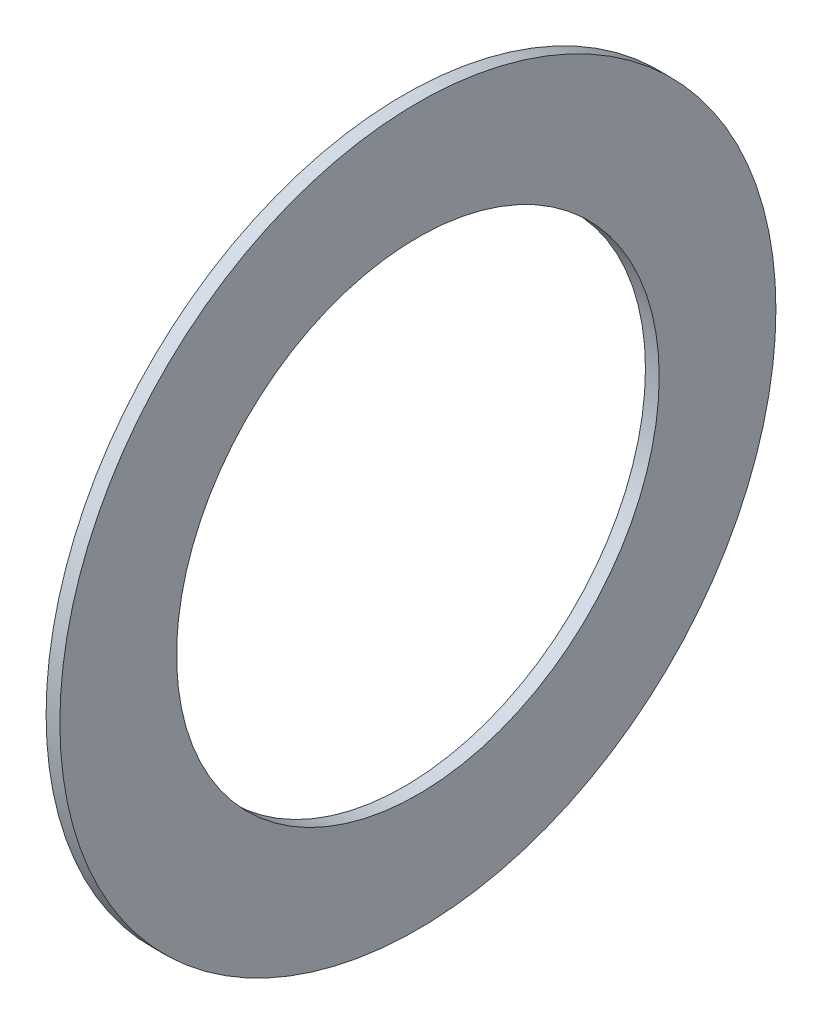
from build123d import *

# Parameters (mm, degrees)
BOSS_EXTRUDE1_DEPTH      = 0.5
BOSS_EXTRUDE1_DEPTH_BACK = 0.5
SKETCH3_R                = 26
SKETCH3_R_2              = 17.525


with BuildPart() as part:
    # Sketch3 → Boss-Extrude1 (new, two sides: drawn at the far end of the back side and taken through both)
    with BuildSketch(Plane(origin=(0, 0, 0), x_dir=(0, 0, -1), z_dir=(1, 0, 0)).offset(-BOSS_EXTRUDE1_DEPTH_BACK)):
        Circle(SKETCH3_R)
        Circle(SKETCH3_R_2, mode=Mode.SUBTRACT)
    extrude(amount=BOSS_EXTRUDE1_DEPTH + BOSS_EXTRUDE1_DEPTH_BACK)


solid = part.part
